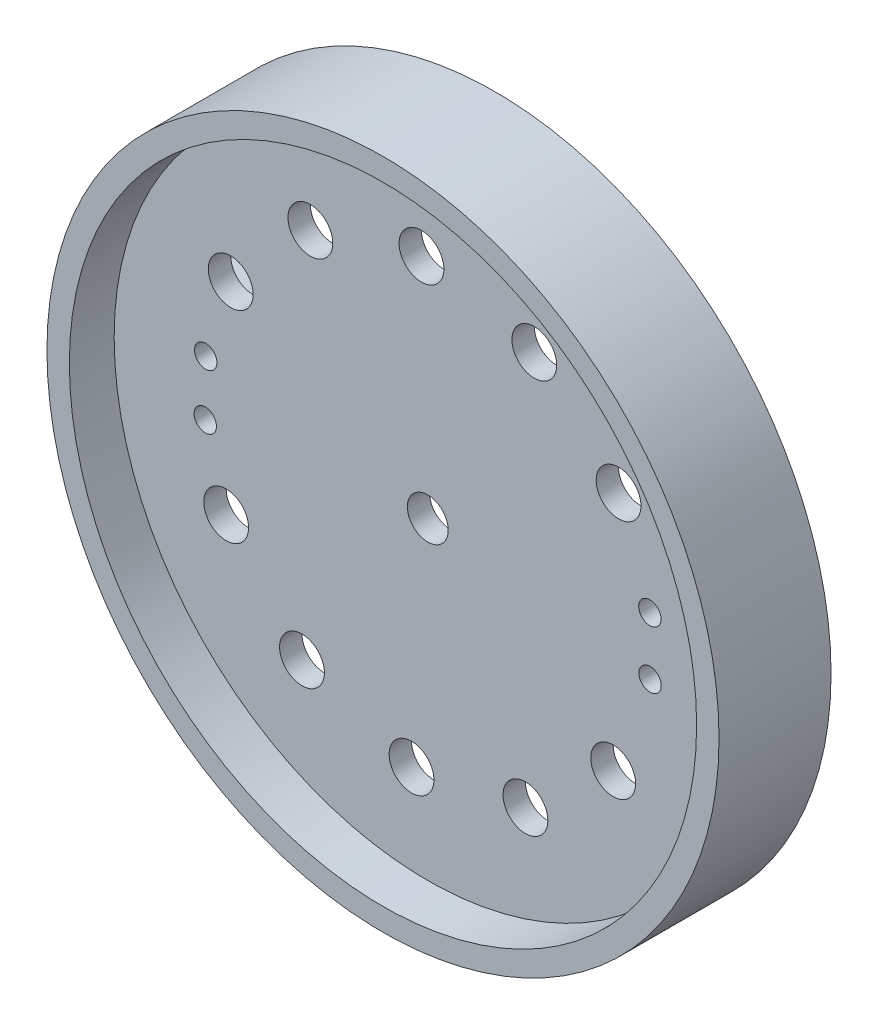
from build123d import *

# Parameters (mm, degrees)
SKETCH1_R               = 38.1
BOSS_EXTRUDE2_DEPTH     = 12.7
SKETCH3_R               = 35.56
CUT_EXTRUDE2_DEPTH      = 5.08
CUT_EXTRUDE3_START      = -5.08
SKETCH4_R               = 35.56
CUT_EXTRUDE3_DEPTH      = 5.08
BOSS_EXTRUDE3_DEPTH     = 5.08
BOSS_EXTRUDE4_DEPTH     = 5.08
SKETCH9_R               = 2.54
CUT_EXTRUDE5_DEPTH      = 55.417684625
CIRPATTERN1_COUNT       = 5
CIRPATTERN1_ANGLE       = 120
SKETCH10_R              = 2.54
CUT_EXTRUDE6_DEPTH      = 55.417684625
CIRPATTERN2_COUNT       = 5
CIRPATTERN2_ANGLE       = 120
CUT_EXTRUDE7_DEPTH      = 55.417684625
CUT_EXTRUDE7_DEPTH_BACK = 55.417684625
SKETCH11_R              = 1.27
CUT_EXTRUDE8_DEPTH      = 55.417684625
CUT_EXTRUDE8_DEPTH_BACK = 55.417684625
SKETCH12_R              = 2.31672553


with BuildPart() as part:
    # Sketch1 → Boss-Extrude2 (new body)
    with BuildSketch(Plane.XY):
        Circle(SKETCH1_R)
    extrude(amount=-BOSS_EXTRUDE2_DEPTH)

    # Sketch3 → Cut-Extrude2 (cut)
    with BuildSketch(Plane.XY):
        Circle(SKETCH3_R)
    extrude(amount=-CUT_EXTRUDE2_DEPTH, mode=Mode.SUBTRACT)

    # Sketch4 → Cut-Extrude3 (cut)
    with BuildSketch(Plane(origin=(0, 0, -12.7), x_dir=(-1, 0, 0), z_dir=(0, 0, -1)).offset(CUT_EXTRUDE3_START)):
        with Locations(Location((0, 0, 0), (0, 0, 180))):
            Circle(SKETCH4_R)
    extrude(amount=CUT_EXTRUDE3_DEPTH, mode=Mode.SUBTRACT)

    # Sketch6 → Boss-Extrude3 (add)
    with BuildSketch(Plane(origin=(0, 0, -7.62), x_dir=(-1, 0, 0), z_dir=(0, 0, -1))):
        with BuildLine():
            Line((-3.81, 0), (-35.56, 0))
            ThreePointArc((-35.56, 0), (-35.25577927, -4.641511395), (-34.348322383, -9.203605244))
            Line((-34.348322383, -9.203605244), (-3.680177398, -0.986100562))
            ThreePointArc((-3.680177398, -0.986100562), (-3.777404922, -0.497304792), (-3.81, 0))
        make_face()
    boss_extrude3 = extrude(amount=BOSS_EXTRUDE3_DEPTH)

    # Mirror2: Boss-Extrude3 across plane
    add(boss_extrude3.mirror(Plane(origin=(3.81, 0, -45.881763645), x_dir=(0, 0, 1), z_dir=(0, -1, 0))))

    # Sketch8 → Boss-Extrude4 (add)
    with BuildSketch(Plane(origin=(0, 0, -7.62), x_dir=(-1, 0, 0), z_dir=(0, 0, -1))):
        with BuildLine():
            Line((3.81, 0), (35.56, 0))
            ThreePointArc((35.56, 0), (35.25577927, -4.641511395), (34.348322383, -9.203605244))
            Line((34.348322383, -9.203605244), (3.680177398, -0.986100562))
            ThreePointArc((3.680177398, -0.986100562), (3.777404922, -0.497304792), (3.81, 0))
        make_face()
    boss_extrude4 = extrude(amount=BOSS_EXTRUDE4_DEPTH)

    # Mirror3: Boss-Extrude4 across plane
    add(boss_extrude4.mirror(Plane(origin=(-3.81, 0, -45.881763645), x_dir=(0, 0, 1), z_dir=(0, -1, 0))))

    # Sketch9 → Cut-Extrude5 (cut, symmetric)
    with BuildSketch(Plane(origin=(0, 0, -7.62), x_dir=(-1, 0, 0), z_dir=(0, 0, -1))):
        with Locations((22.346538839, 12.074444166)):
            Circle(SKETCH9_R)
    cut_extrude5 = extrude(amount=CUT_EXTRUDE5_DEPTH, both=True, mode=Mode.SUBTRACT)

    # CirPattern1: Cut-Extrude5 ×5 about axis
    cirpattern1_axis = Axis((0, 0, 0), (0, 0, -1))
    for i in range(1, CIRPATTERN1_COUNT):
        add(cut_extrude5.rotate(cirpattern1_axis, i * CIRPATTERN1_ANGLE / (CIRPATTERN1_COUNT - 1)), mode=Mode.SUBTRACT)

    # Sketch10 → Cut-Extrude6 (cut, symmetric)
    with BuildSketch(Plane(origin=(0, 0, -7.62), x_dir=(-1, 0, 0), z_dir=(0, 0, -1))):
        with Locations((22.86059693, -11.070370726)):
            Circle(SKETCH10_R)
    cut_extrude6 = extrude(amount=CUT_EXTRUDE6_DEPTH, both=True, mode=Mode.SUBTRACT)

    # CirPattern2: Cut-Extrude6 ×5 about axis
    cirpattern2_axis = Axis((0, 0, 0), (0, 0, 1))
    for i in range(1, CIRPATTERN2_COUNT):
        add(cut_extrude6.rotate(cirpattern2_axis, i * CIRPATTERN2_ANGLE / (CIRPATTERN2_COUNT - 1)), mode=Mode.SUBTRACT)

    # Sketch11 → Cut-Extrude7 (cut, two sides: drawn at the far end of the back side and taken through both)
    with BuildSketch(Plane(origin=(0, 0, -7.62), x_dir=(-1, 0, 0), z_dir=(0, 0, -1)).offset(-CUT_EXTRUDE7_DEPTH_BACK)):
        with Locations((-25.180527268, 3.331823302)):
            Circle(SKETCH11_R)
        with Locations((-25.198683581, -3.191605521)):
            Circle(SKETCH11_R)
        with Locations((25.180527268, 3.331823302)):
            Circle(SKETCH11_R)
        with Locations((25.229521307, -2.937899696)):
            Circle(SKETCH11_R)
    extrude(amount=CUT_EXTRUDE7_DEPTH + CUT_EXTRUDE7_DEPTH_BACK, mode=Mode.SUBTRACT)

    # Sketch12 → Cut-Extrude8 (cut, two sides: drawn at the far end of the back side and taken through both)
    with BuildSketch(Plane(origin=(0, 0, -7.62), x_dir=(-1, 0, 0), z_dir=(0, 0, -1)).offset(-CUT_EXTRUDE8_DEPTH_BACK)):
        Circle(SKETCH12_R)
    extrude(amount=CUT_EXTRUDE8_DEPTH + CUT_EXTRUDE8_DEPTH_BACK, mode=Mode.SUBTRACT)


solid = part.part
